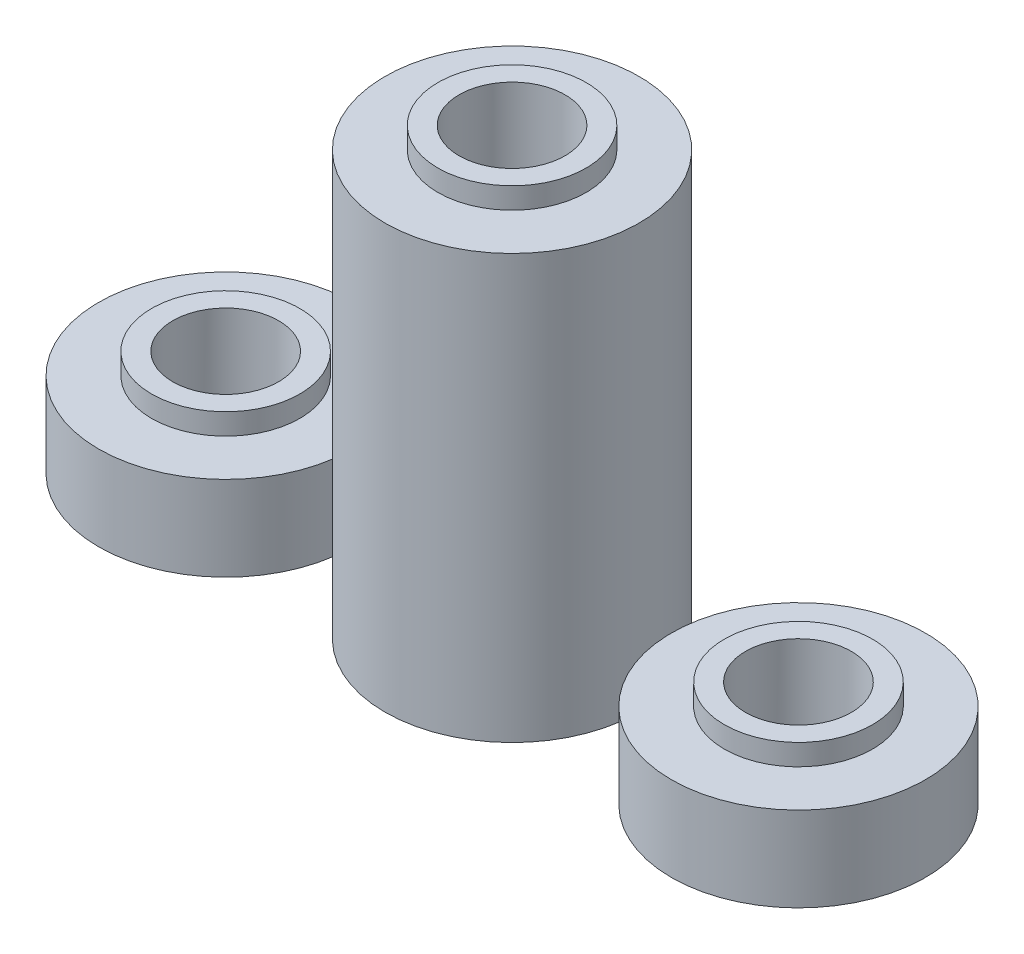
from build123d import *

# Parameters (mm, degrees)
CROQUIS1_R              = 6
SALIENTE_EXTRUIR1_DEPTH = 20
CROQUIS2_R              = 2.5
CORTAR_EXTRUIR1_DEPTH   = 20
SALIENTE_EXTRUIR2_START = 1
CROQUIS3_R              = 3.5
CROQUIS3_R_2            = 2.5
SALIENTE_EXTRUIR2_DEPTH = 1
CROQUIS4_R              = 4.5
CORTAR_EXTRUIR2_DEPTH   = 5
CROQUIS5_R              = 6
SALIENTE_EXTRUIR3_DEPTH = 4
CROQUIS6_R              = 2.5
CORTAR_EXTRUIR3_DEPTH   = 4
CROQUIS7_R              = 3.5
CROQUIS7_R_2            = 2.5
SALIENTE_EXTRUIR4_DEPTH = 1
CROQUIS8_R              = 3.5
CROQUIS8_R_2            = 2.5
CORTAR_EXTRUIR4_DEPTH   = 1


with BuildPart() as part:
    # Croquis1 → Saliente-Extruir1 (new body)
    with BuildSketch(Plane(origin=(0, 0, 0), x_dir=(1, 0, 0), z_dir=(0, 1, 0))):
        with Locations(Location((0, 0, 0), (0, 0, 270))):
            Circle(CROQUIS1_R)
    extrude(amount=SALIENTE_EXTRUIR1_DEPTH)

    # Croquis2 → Cortar-Extruir1 (cut)
    with BuildSketch(Plane(origin=(0, 20, 0), x_dir=(1, 0, 0), z_dir=(0, 1, 0))):
        with Locations(Location((0, 0, 0), (0, 0, 270))):
            Circle(CROQUIS2_R)
    extrude(amount=-CORTAR_EXTRUIR1_DEPTH, mode=Mode.SUBTRACT)

    # Croquis3 → Saliente-Extruir2 (add)
    with BuildSketch(Plane(origin=(0, 20, 0), x_dir=(1, 0, 0), z_dir=(0, 1, 0)).offset(SALIENTE_EXTRUIR2_START)):
        with Locations(Location((0, 0, 0), (0, 0, 270))):
            Circle(CROQUIS3_R)
        with Locations(Location((0, 0, 0), (0, 0, 270))):
            Circle(CROQUIS3_R_2, mode=Mode.SUBTRACT)
    extrude(amount=-SALIENTE_EXTRUIR2_DEPTH)

    # Croquis4 → Cortar-Extruir2 (cut)
    with BuildSketch(Plane.XZ):
        with Locations(Location((0, 0, 0), (0, 0, 270))):
            Circle(CROQUIS4_R)
    extrude(amount=-CORTAR_EXTRUIR2_DEPTH, mode=Mode.SUBTRACT)


with BuildPart() as body_2:
    # Croquis5 → Saliente-Extruir3 (new body)
    with BuildSketch(Plane(origin=(0, 0, 0), x_dir=(1, 0, 0), z_dir=(0, 1, 0))):
        with Locations(Location((-13.521991575, 0, 0), (0, 0, 270))):
            Circle(CROQUIS5_R)
    extrude(amount=SALIENTE_EXTRUIR3_DEPTH)

    # Croquis6 → Cortar-Extruir3 (cut)
    with BuildSketch(Plane(origin=(0, 4, 0), x_dir=(1, 0, 0), z_dir=(0, 1, 0))):
        with Locations(Location((-13.521991575, 0, 0), (0, 0, 270))):
            Circle(CROQUIS6_R)
    extrude(amount=-CORTAR_EXTRUIR3_DEPTH, mode=Mode.SUBTRACT)

    # Croquis7 → Saliente-Extruir4 (add)
    with BuildSketch(Plane(origin=(0, 4, 0), x_dir=(1, 0, 0), z_dir=(0, 1, 0))):
        with Locations(Location((-13.521991575, 0, 0), (0, 0, 270))):
            Circle(CROQUIS7_R)
        with Locations(Location((-13.521991575, 0, 0), (0, 0, 270))):
            Circle(CROQUIS7_R_2, mode=Mode.SUBTRACT)
    extrude(amount=SALIENTE_EXTRUIR4_DEPTH)

    # Croquis8 → Cortar-Extruir4 (cut)
    with BuildSketch(Plane.XZ):
        with Locations(Location((-13.521991575, 0, 0), (0, 0, 90))):
            Circle(CROQUIS8_R)
        with Locations(Location((-13.521991575, 0, 0), (0, 0, 90))):
            Circle(CROQUIS8_R_2, mode=Mode.SUBTRACT)
    extrude(amount=-CORTAR_EXTRUIR4_DEPTH, mode=Mode.SUBTRACT)


with BuildPart() as body_3:
    # Simetría2: mirrored copy
    add(body_2.part.mirror(Plane(origin=(0, 0, 0), x_dir=(0, 0, 1), z_dir=(1, 0, 0))))


solid = Compound([part.part, body_2.part, body_3.part])
